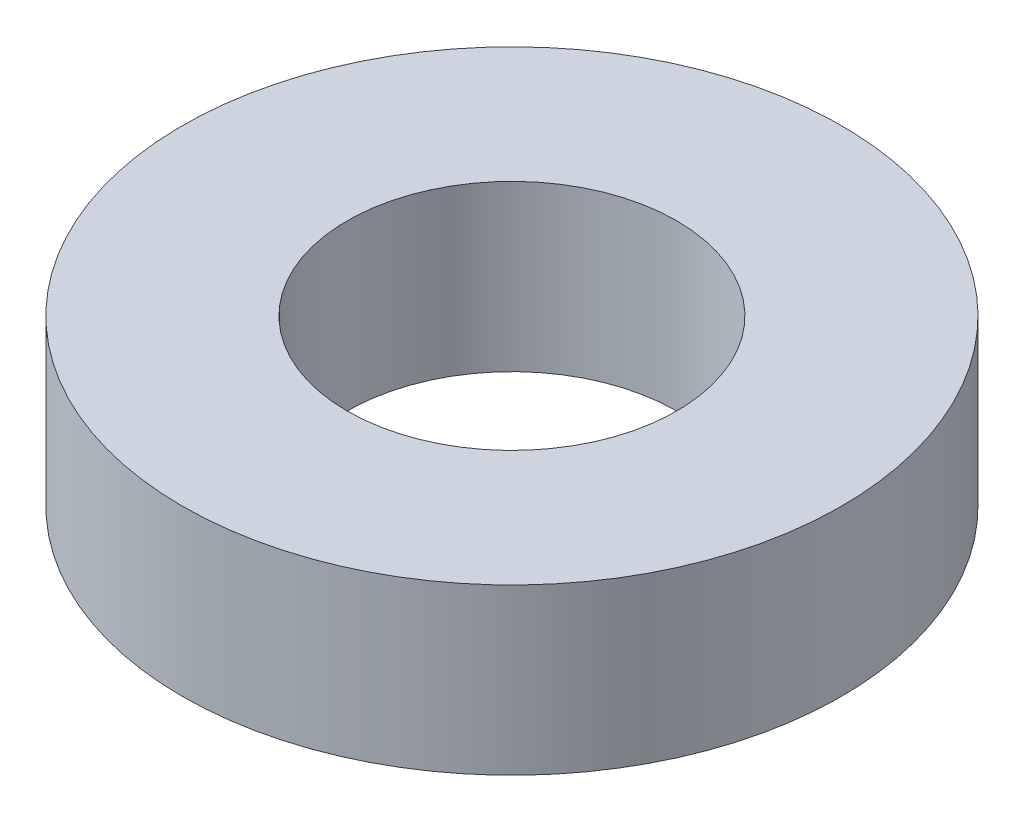
from build123d import *

# Parameters (mm, degrees)
SKETCH1_R           = 6
SKETCH1_R_2         = 3
BOSS_EXTRUDE1_DEPTH = 1.5


with BuildPart() as part:
    # Sketch1 → Boss-Extrude1 (new, symmetric)
    with BuildSketch(Plane(origin=(0, 0, 0), x_dir=(1, 0, 0), z_dir=(0, 1, 0))):
        with Locations(Location((0, 0, 0), (0, 0, 270))):
            Circle(SKETCH1_R)
        with Locations(Location((0, 0, 0), (0, 0, 270))):
            Circle(SKETCH1_R_2, mode=Mode.SUBTRACT)
    extrude(amount=BOSS_EXTRUDE1_DEPTH, both=True)


solid = part.part
